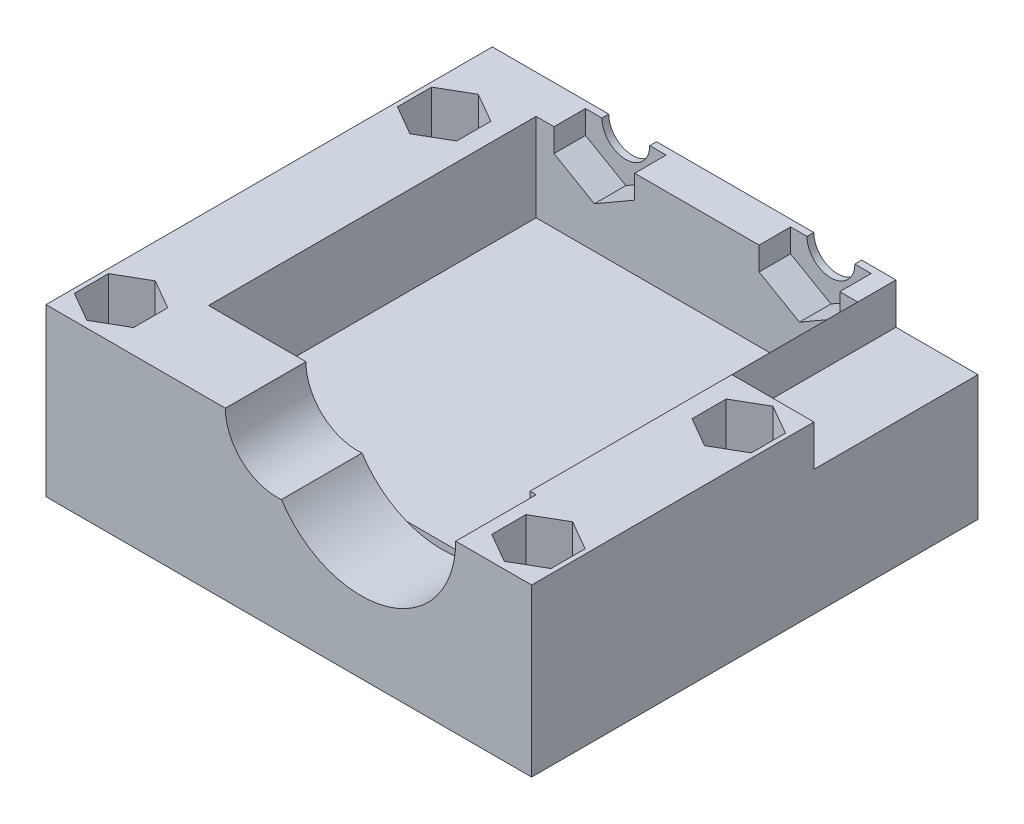
from build123d import *

# Parameters (mm, degrees)
SKETCH1_W               = 35.519995
SKETCH1_H               = 32.6499982
BOSS_EXTRUDE1_DEPTH     = 12.1700036
CUT_EXTRUDE1_DEPTH      = 29.893301397
CUT_EXTRUDE1_DEPTH_BACK = 5.2499768
SKETCH3_W               = 5.999988
SKETCH3_H               = 12.0000014
CUT_EXTRUDE2_DEPTH      = 2.999994
SKETCH4_W               = 23.5199936
SKETCH4_H               = 23.9599978
CUT_EXTRUDE3_DEPTH      = 6.4250062
CUT_EXTRUDE5_DEPTH      = 5.890006
CUT_EXTRUDE6_DEPTH      = 2.2999954
SKETCH8_R               = 1.7499965
CUT_EXTRUDE7_DEPTH      = 2.7999944


with BuildPart() as part:
    # Sketch1 → Boss-Extrude1 (new body)
    with BuildSketch(Plane(origin=(0, 0, 0), x_dir=(1, 0, 0), z_dir=(0, 1, 0))):
        with Locations((1.4404975, 1.509093805)):
            Rectangle(SKETCH1_W, SKETCH1_H)
    extrude(amount=BOSS_EXTRUDE1_DEPTH)

    # Sketch2 → Cut-Extrude1 (cut, two sides: drawn at the far end of the back side and taken through both)
    with BuildSketch(Plane(origin=(0, 12.1700036, 0), x_dir=(1, 0, 0), z_dir=(0, 1, 0)).offset(-CUT_EXTRUDE1_DEPTH_BACK)):
        Polygon((-13.8303, -9.315916295), (-15.995359179, -10.565913795), (-15.995359179, -13.065908795), (-13.8303, -14.315906295), (-11.665240821, -13.065908795), (-11.665240821, -10.565913795), align=None)
        Polygon((-11.665240821, 10.565913795), (-13.8303, 9.315916295), (-15.995359179, 10.565913795), (-15.995359179, 13.065908795), (-13.8303, 14.315906295), (-11.665240821, 13.065908795), align=None)
        Polygon((16.7005, 5.334067105), (14.535440821, 4.084069605), (14.535440821, 1.584074605), (16.7005, 0.334077105), (18.865559179, 1.584074605), (18.865559179, 4.084069605), align=None)
        Polygon((16.7005, -14.315906295), (18.865559179, -13.065908795), (18.865559179, -10.565913795), (16.7005, -9.315916295), (14.535440821, -10.565913795), (14.535440821, -13.065908795), align=None)
    extrude(amount=CUT_EXTRUDE1_DEPTH + CUT_EXTRUDE1_DEPTH_BACK, mode=Mode.SUBTRACT)

    # Sketch3 → Cut-Extrude2 (cut)
    with BuildSketch(Plane(origin=(0, 12.1700036, 0), x_dir=(1, 0, 0), z_dir=(0, 1, 0))):
        with Locations((16.200501, 11.834092205)):
            Rectangle(SKETCH3_W, SKETCH3_H)
    extrude(amount=-CUT_EXTRUDE2_DEPTH, mode=Mode.SUBTRACT)

    # Sketch4 → Cut-Extrude3 (cut)
    with BuildSketch(Plane(origin=(0, 12.1700036, 0), x_dir=(1, 0, 0), z_dir=(0, 1, 0))):
        with Locations((1.4404848, 3.054099605)):
            Rectangle(SKETCH4_W, SKETCH4_H)
    extrude(amount=-CUT_EXTRUDE3_DEPTH, mode=Mode.SUBTRACT)

    # Sketch6 → Cut-Extrude5 (cut)
    with BuildSketch(Plane.XY.offset(14.815905295)):
        with BuildLine():
            ThreePointArc((0.90468468, 8.436788325), (13.6504934, 12.1700036), (0.90468468, 15.903218875))
            ThreePointArc((0.90468468, 15.903218875), (-3.199511, 12.1700036), (0.90468468, 8.436788325))
        make_face()
    extrude(amount=-CUT_EXTRUDE5_DEPTH, mode=Mode.SUBTRACT)

    # Sketch7 → Cut-Extrude6 (cut)
    with BuildSketch(Plane.XY.offset(-15.034098505)):
        Polygon((8.9404952, 8.763635), (11.890496942, 10.4668193), (11.890496942, 13.8731879), (8.9404952, 15.5763722), (5.990493458, 13.8731879), (5.990493458, 10.4668193), align=None)
        Polygon((-6.0595002, 8.763635), (-3.109498458, 10.4668193), (-3.109498458, 13.8731879), (-6.0595002, 15.5763722), (-9.009501942, 13.8731879), (-9.009501942, 10.4668193), align=None)
    extrude(amount=-CUT_EXTRUDE6_DEPTH, mode=Mode.SUBTRACT)

    # Sketch8 → Cut-Extrude7 (cut)
    with BuildSketch(Plane(origin=(0, 0, -17.834092905), x_dir=(-1, 0, 0), z_dir=(0, 0, -1))):
        with Locations((-8.9404952, 12.1700036)):
            Circle(SKETCH8_R)
        with Locations((6.0595002, 12.1700036)):
            Circle(SKETCH8_R)
    extrude(amount=-CUT_EXTRUDE7_DEPTH, mode=Mode.SUBTRACT)


solid = part.part
